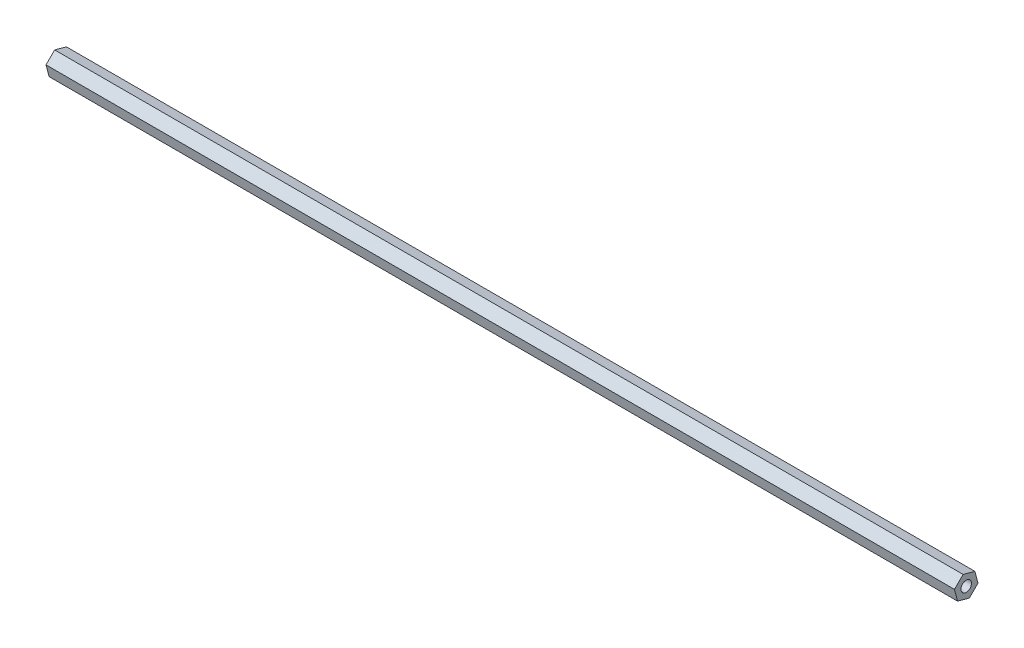
from build123d import *

# Parameters (mm, degrees)
BOSS_EXTRUDE1_DEPTH = 546.1
SKETCH2_R           = 3.175
CUT_EXTRUDE1_DEPTH  = 547.191845578


with BuildPart() as part:
    # Sketch1 → Boss-Extrude1 (new body)
    with BuildSketch(Plane(origin=(0, 0, 0), x_dir=(0, 0, -1), z_dir=(1, 0, 0))):
        Polygon((5.205999397, 5.16341976), (-1.868652984, 7.090237609), (-7.074652381, 1.92681785), (-5.205999397, -5.16341976), (1.868652984, -7.090237609), (7.074652381, -1.92681785), align=None)
    extrude(amount=BOSS_EXTRUDE1_DEPTH)

    # Sketch2 → Cut-Extrude1 (cut, through all)
    with BuildSketch(Plane(origin=(546.1, 0, 0), x_dir=(0, 0, -1), z_dir=(1, 0, 0))):
        Circle(SKETCH2_R)
    extrude(amount=-CUT_EXTRUDE1_DEPTH, mode=Mode.SUBTRACT)


solid = part.part
